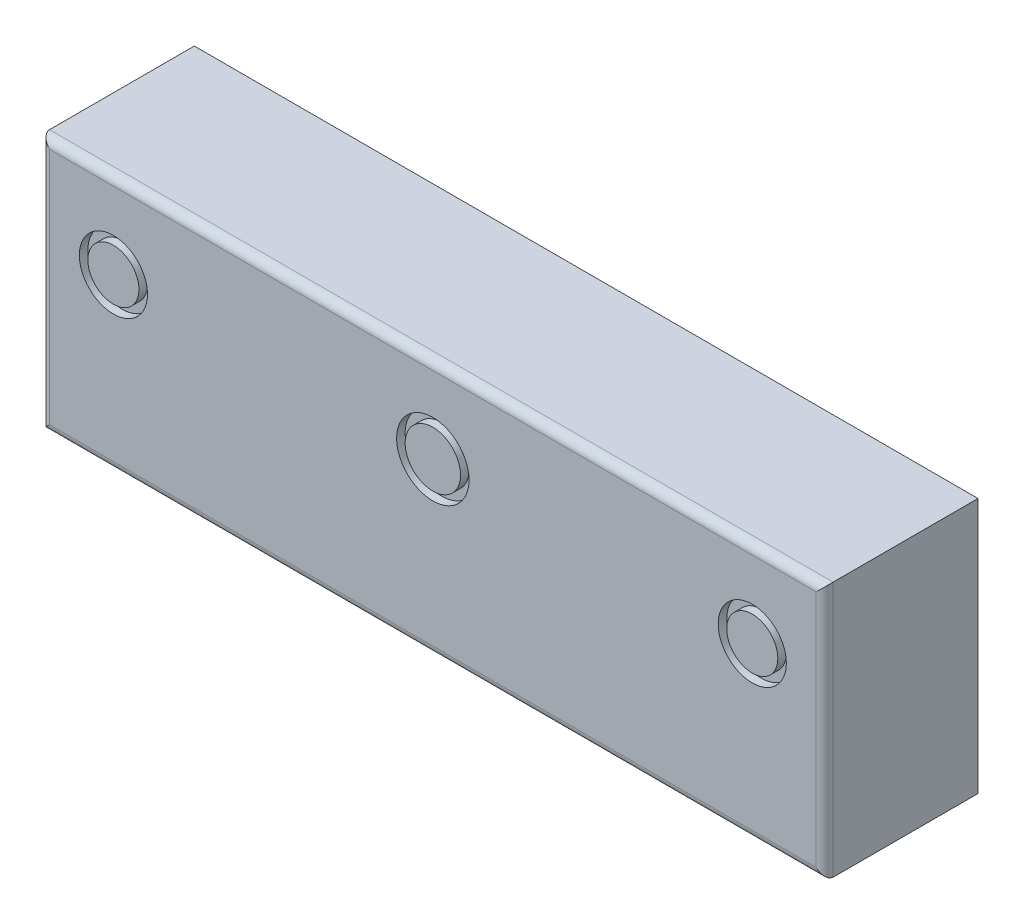
from build123d import *

# Parameters (mm, degrees)
SKETCH1_W           = 92
SKETCH1_H           = 30
BOSS_EXTRUDE1_DEPTH = 18
SKETCH2_R           = 4
SKETCH2_R_2         = 3
SKETCH2_R_3         = 4.25
SKETCH2_R_4         = 3.25
CUT_EXTRUDE1_DEPTH  = 1
FILLET1_R           = 1


with BuildPart() as part:
    # Sketch1 → Boss-Extrude1 (new body)
    with BuildSketch(Plane.XY):
        Rectangle(SKETCH1_W, SKETCH1_H)
    extrude(amount=BOSS_EXTRUDE1_DEPTH)

    # Sketch2 → Cut-Extrude1 (cut)
    # profile 1 of 3: a face of its own
    with BuildSketch(Plane.XY.offset(18)):
        with Locations((-37.5, 5)):
            Circle(SKETCH2_R)
        with Locations((-37.5, 5)):
            Circle(SKETCH2_R_2, mode=Mode.SUBTRACT)
    # profile 2 of 3: a face of its own
    with BuildSketch(Plane.XY.offset(18)):
        with Locations((0, 5)):
            Circle(SKETCH2_R_3)
        with Locations((0, 5)):
            Circle(SKETCH2_R_4, mode=Mode.SUBTRACT)
    # profile 3 of 3: a face of its own
    with BuildSketch(Plane.XY.offset(18)):
        with Locations((37.5, 5)):
            Circle(SKETCH2_R)
        with Locations((37.5, 5)):
            Circle(SKETCH2_R_2, mode=Mode.SUBTRACT)
    extrude(amount=-CUT_EXTRUDE1_DEPTH, mode=Mode.SUBTRACT)

    # Fillet1
    fillet1_edges = [part.edges().sort_by_distance(p)[0] for p in [
        (-46, 0, 18),
        (0, -15, 18),
        (46, 0, 18),
        (0, 15, 18),
    ]]
    fillet(fillet1_edges, radius=FILLET1_R)


solid = part.part
